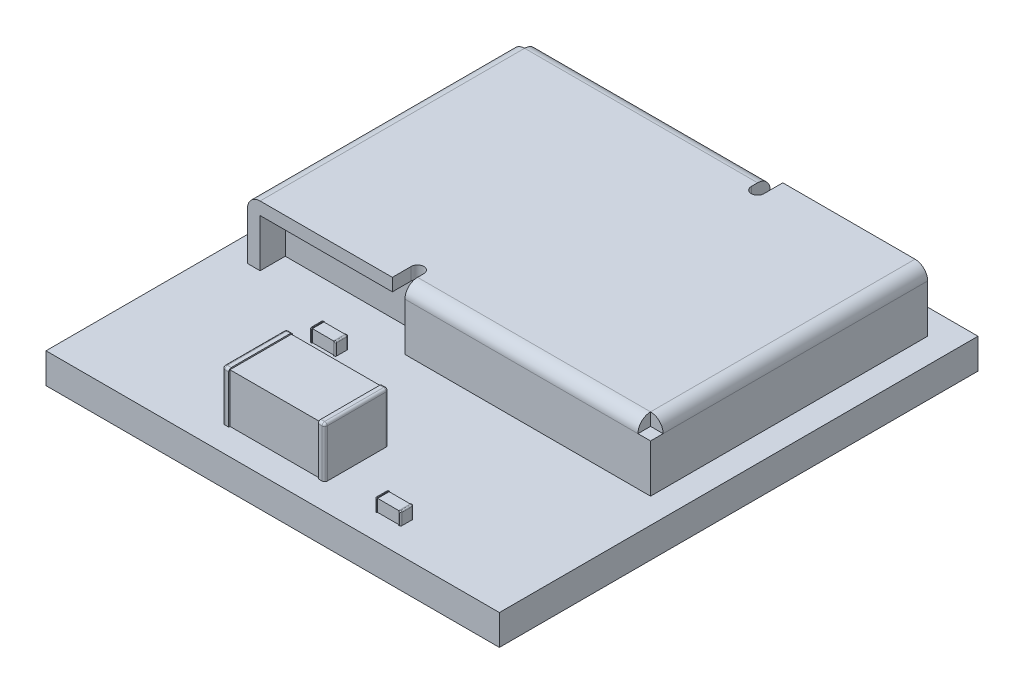
from build123d import *

# Parameters (mm, degrees)
SKETCH1_W           = 9
SKETCH1_H           = 9.5
BOSS_EXTRUDE1_DEPTH = 0.6
SKETCH2_W           = 8
SKETCH2_H           = 5.5
BOSS_EXTRUDE2_DEPTH = 1.2
CUT_EXTRUDE1_DEPTH  = 1.2
SKETCH4_W           = 0.25
SKETCH4_H           = 0.25
CUT_EXTRUDE2_DEPTH  = 0.25
FILLET1_R           = 0.25
SKETCH5_W           = 2.875
SKETCH5_H           = 0.95
CUT_EXTRUDE3_DEPTH  = 0.5
SKETCH7_W           = 2.875
SKETCH7_H           = 0.95
CUT_EXTRUDE4_DEPTH  = 0.5
BOSS_EXTRUDE3_DEPTH = 1
SKETCH9_W           = 1.778
SKETCH9_H           = 1.2192
CUT_EXTRUDE5_DEPTH  = 0.0254
FILLET2_R           = 0.0508
BOSS_EXTRUDE4_DEPTH = 0.254
SKETCH11_W          = 0.4318
SKETCH11_H          = 0.2286
CUT_EXTRUDE6_DEPTH  = 0.0127
FILLET3_R           = 0.0254


with BuildPart() as part:
    # Sketch1 → Boss-Extrude1 (new body)
    with BuildSketch(Plane(origin=(0, 0, 0), x_dir=(1, 0, 0), z_dir=(0, 1, 0))):
        Rectangle(SKETCH1_W, SKETCH1_H)
    extrude(amount=BOSS_EXTRUDE1_DEPTH)

    # Sketch2 → Boss-Extrude2 (add)
    with BuildSketch(Plane(origin=(0, 0.6, 0), x_dir=(1, 0, 0), z_dir=(0, 1, 0))):
        with Locations((0, 1.5)):
            Rectangle(SKETCH2_W, SKETCH2_H)
    extrude(amount=BOSS_EXTRUDE2_DEPTH)

    # Sketch3 → Cut-Extrude1 (cut)
    with BuildSketch(Plane(origin=(0, 1.8, 0), x_dir=(1, 0, 0), z_dir=(0, 1, 0))):
        with BuildLine():
            Line((0.875, 4.25), (0.875, 3.875))
            ThreePointArc((0.875, 3.875), (1, 3.75), (1.125, 3.875))
            Line((1.125, 3.875), (1.125, 4.25))
            Line((1.125, 4.25), (0.875, 4.25))
        make_face()
        with BuildLine():
            Line((-1.125, -0.875), (-1.125, -1.25))
            Line((-1.125, -1.25), (-0.875, -1.25))
            Line((-0.875, -1.25), (-0.875, -0.875))
            ThreePointArc((-0.875, -0.875), (-1, -0.75), (-1.125, -0.875))
        make_face()
    extrude(amount=-CUT_EXTRUDE1_DEPTH, mode=Mode.SUBTRACT)

    # Sketch4 → Cut-Extrude2 (cut)
    with BuildSketch(Plane(origin=(0, 1.8, 0), x_dir=(1, 0, 0), z_dir=(0, 1, 0))):
        with Locations((3.875, -1.125)):
            Rectangle(SKETCH4_W, SKETCH4_H)
        with Locations((-3.875, 4.125)):
            Rectangle(SKETCH4_W, SKETCH4_H)
    extrude(amount=-CUT_EXTRUDE2_DEPTH, mode=Mode.SUBTRACT)

    # Fillet1
    fillet1_edges = [part.edges().sort_by_distance(p)[0] for p in [
        (-1.4375, 1.8, -4.25),
        (4, 1.8, -1.625),
        (1.4375, 1.8, 1.25),
        (-4, 1.8, -1.375),
    ]]
    fillet(fillet1_edges, radius=FILLET1_R)

    # Sketch5 → Cut-Extrude3 (cut)
    with BuildSketch(Plane.XY.offset(1.25)):
        with Locations((-2.3125, 1.075)):
            Rectangle(SKETCH5_W, SKETCH5_H)
    extrude(amount=-CUT_EXTRUDE3_DEPTH, mode=Mode.SUBTRACT)

    # Sketch7 → Cut-Extrude4 (cut)
    with BuildSketch(Plane(origin=(0, 0, -4.25), x_dir=(-1, 0, 0), z_dir=(0, 0, -1))):
        with Locations((-2.3125, 1.075)):
            Rectangle(SKETCH7_W, SKETCH7_H)
    extrude(amount=-CUT_EXTRUDE4_DEPTH, mode=Mode.SUBTRACT)

    # Sketch8 → Boss-Extrude3 (add)
    with BuildSketch(Plane(origin=(0, 0.6, 0), x_dir=(1, 0, 0), z_dir=(0, 1, 0))):
        Polygon((-1.5, -2.98), (-1.373, -2.98), (-1.373, -3.0054), (0.405, -3.0054), (0.405, -2.98), (0.532, -2.98), (0.532, -4.25), (0.405, -4.25), (0.405, -4.2246), (-1.373, -4.2246), (-1.373, -4.25), (-1.5, -4.25), align=None)
    extrude(amount=BOSS_EXTRUDE3_DEPTH)

    # Sketch9 → Cut-Extrude5 (cut)
    with BuildSketch(Plane(origin=(0, 1.6, 0), x_dir=(1, 0, 0), z_dir=(0, 1, 0))):
        with Locations((-0.484, -3.615)):
            Rectangle(SKETCH9_W, SKETCH9_H)
    extrude(amount=-CUT_EXTRUDE5_DEPTH, mode=Mode.SUBTRACT)

    # Fillet2
    fillet2_edges = [part.edges().sort_by_distance(p)[0] for p in [
        (-1.5, 1.1, 2.98),
        (-1.5, 1.1, 4.25),
        (0.532, 1.1, 4.25),
        (0.532, 1.1, 2.98),
        (-1.5, 1.6, 3.615),
        (-1.4365, 1.6, 4.25),
        (0.4685, 1.6, 4.25),
        (0.532, 1.6, 3.615),
        (0.4685, 1.6, 2.98),
        (-1.4365, 1.6, 2.98),
    ]]
    fillet(fillet2_edges, radius=FILLET2_R)

    # Sketch10 → Boss-Extrude4 (add)
    with BuildSketch(Plane(origin=(0, 0.6, 0), x_dir=(1, 0, 0), z_dir=(0, 1, 0))):
        Polygon((-2.033, -1.726), (-1.9949, -1.726), (-1.9949, -1.7387), (-1.5631, -1.7387), (-1.5631, -1.726), (-1.525, -1.726), (-1.525, -1.98), (-1.5631, -1.98), (-1.5631, -1.9673), (-1.9949, -1.9673), (-1.9949, -1.98), (-2.033, -1.98), align=None)
        Polygon((1.532, -3.996), (1.5701, -3.996), (1.5701, -4.0087), (2.0019, -4.0087), (2.0019, -3.996), (2.04, -3.996), (2.04, -4.25), (2.0019, -4.25), (2.0019, -4.2373), (1.5701, -4.2373), (1.5701, -4.25), (1.532, -4.25), align=None)
    extrude(amount=BOSS_EXTRUDE4_DEPTH)

    # Sketch11 → Cut-Extrude6 (cut)
    with BuildSketch(Plane(origin=(0, 0.854, 0), x_dir=(1, 0, 0), z_dir=(0, 1, 0))):
        with Locations((-1.779, -1.853)):
            Rectangle(SKETCH11_W, SKETCH11_H)
        with Locations((1.786, -4.123)):
            Rectangle(SKETCH11_W, SKETCH11_H)
    extrude(amount=-CUT_EXTRUDE6_DEPTH, mode=Mode.SUBTRACT)

    # Fillet3
    fillet3_edges = [part.edges().sort_by_distance(p)[0] for p in [
        (-2.033, 0.727, 1.726),
        (-2.033, 0.727, 1.98),
        (-1.525, 0.727, 1.98),
        (-1.525, 0.727, 1.726),
        (-2.033, 0.854, 1.853),
        (-2.01395, 0.854, 1.98),
        (-1.54405, 0.854, 1.98),
        (-1.525, 0.854, 1.853),
        (-1.54405, 0.854, 1.726),
        (-2.01395, 0.854, 1.726),
        (1.532, 0.727, 3.996),
        (1.532, 0.727, 4.25),
        (2.04, 0.727, 4.25),
        (2.04, 0.727, 3.996),
        (1.532, 0.854, 4.123),
        (1.55105, 0.854, 4.25),
        (2.02095, 0.854, 4.25),
        (2.04, 0.854, 4.123),
        (2.02095, 0.854, 3.996),
        (1.55105, 0.854, 3.996),
    ]]
    fillet(fillet3_edges, radius=FILLET3_R)


solid = part.part
